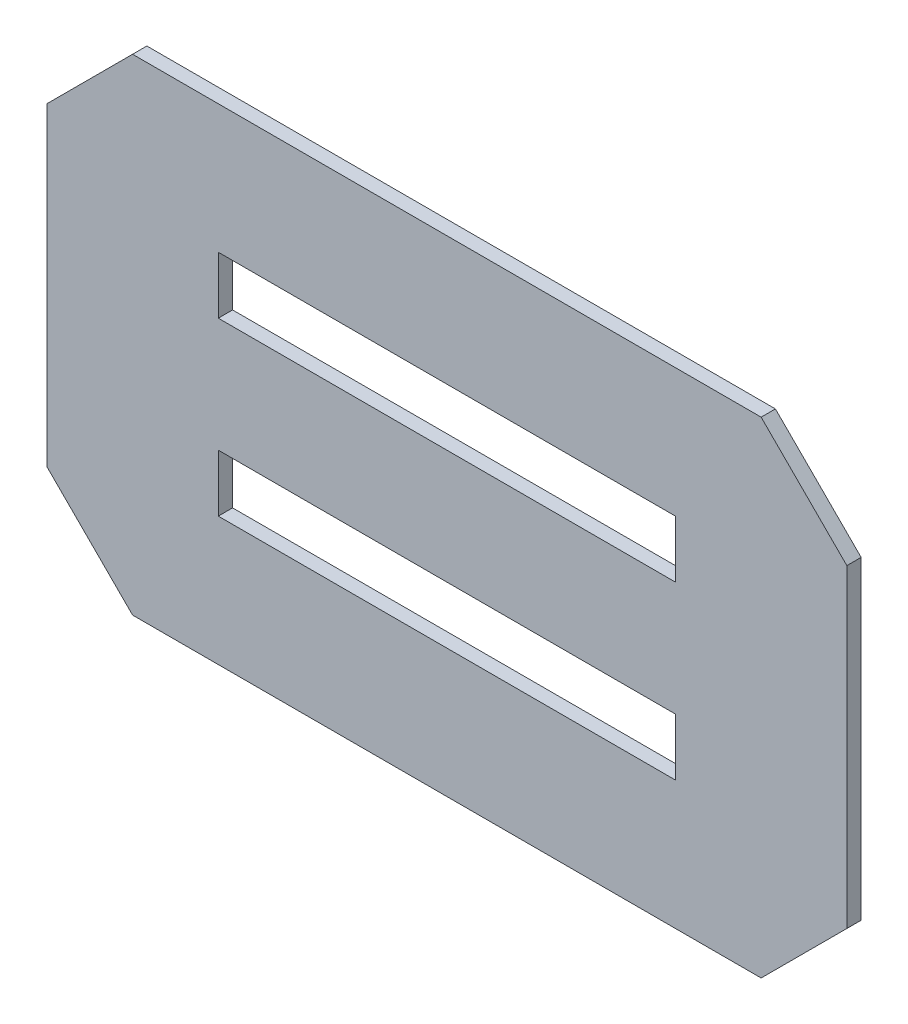
from build123d import *

# Parameters (mm, degrees)
SKETCH_1_W      = 16
SKETCH_1_H      = 2
EXTRUDE_1_DEPTH = 0.5


with BuildPart() as part:
    # 草图1 → 凸台-拉伸1 (new body)
    with BuildSketch(Plane.XY):
        Polygon((-14, 5.5), (-11, 8.5), (11, 8.5), (14, 5.5), (14, -5.5), (11, -8.5), (-11, -8.5), (-14, -5.5), align=None)
        with Locations((0, 3)):
            Rectangle(SKETCH_1_W, SKETCH_1_H, mode=Mode.SUBTRACT)
        with Locations((0, -3)):
            Rectangle(SKETCH_1_W, SKETCH_1_H, mode=Mode.SUBTRACT)
    extrude(amount=EXTRUDE_1_DEPTH)


solid = part.part
